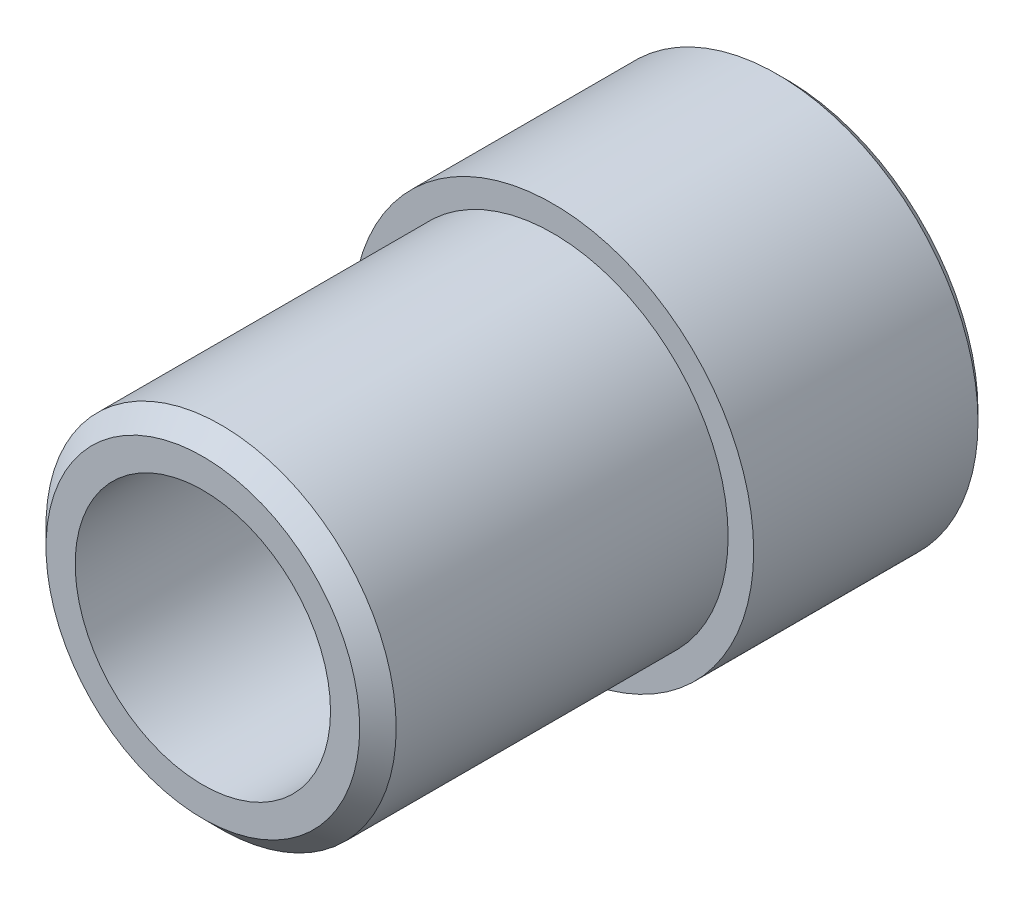
from build123d import *

# Parameters (mm, degrees)
SKETCH_1_R      = 11
SKETCH_1_R_2    = 8.4
EXTRUDE_1_DEPTH = 2
SKETCH_2_R      = 9.6
SKETCH_2_R_2    = 7
EXTRUDE_2_DEPTH = 30
CHAMFER_1_SIZE  = 0.5
SKETCH_3_R      = 11
SKETCH_3_R_2    = 9.6
EXTRUDE_3_DEPTH = 10.8
CHAMFER_2_SIZE  = 1
CHAMFER_3_SIZE  = 0.3
CHAMFER_4_SIZE  = 0.5


with BuildPart() as part:
    # 스케치1 → 보스-돌출1 (new body)
    with BuildSketch(Plane.XY):
        Circle(SKETCH_1_R)
        Circle(SKETCH_1_R_2, mode=Mode.SUBTRACT)
    extrude(amount=EXTRUDE_1_DEPTH)

    # 스케치2 → 보스-돌출2 (add)
    with BuildSketch(Plane.XY.offset(2)):
        Circle(SKETCH_2_R)
        Circle(SKETCH_2_R_2, mode=Mode.SUBTRACT)
    extrude(amount=EXTRUDE_2_DEPTH)

    # 모따기1
    chamfer_1_edges = [part.edges().sort_by_distance(p)[0] for p in [
        (-8.4, 0, 0),
    ]]
    chamfer(chamfer_1_edges, length=CHAMFER_1_SIZE)

    # 스케치3 → 보스-돌출3 (add)
    with BuildSketch(Plane.XY.offset(2)):
        Circle(SKETCH_3_R)
        Circle(SKETCH_3_R_2, mode=Mode.SUBTRACT)
    extrude(amount=EXTRUDE_3_DEPTH)

    # 모따기2
    chamfer_2_edges = [part.edges().sort_by_distance(p)[0] for p in [
        (-9.6, 0, 32),
    ]]
    chamfer(chamfer_2_edges, length=CHAMFER_2_SIZE)

    # 모따기3
    chamfer_3_edges = [part.edges().sort_by_distance(p)[0] for p in [
        (-8.4, 0, 2),
    ]]
    chamfer(chamfer_3_edges, length=CHAMFER_3_SIZE)

    # 모따기4
    chamfer_4_edges = [part.edges().sort_by_distance(p)[0] for p in [
        (-11, 0, 0),
    ]]
    chamfer(chamfer_4_edges, length=CHAMFER_4_SIZE)


solid = part.part
